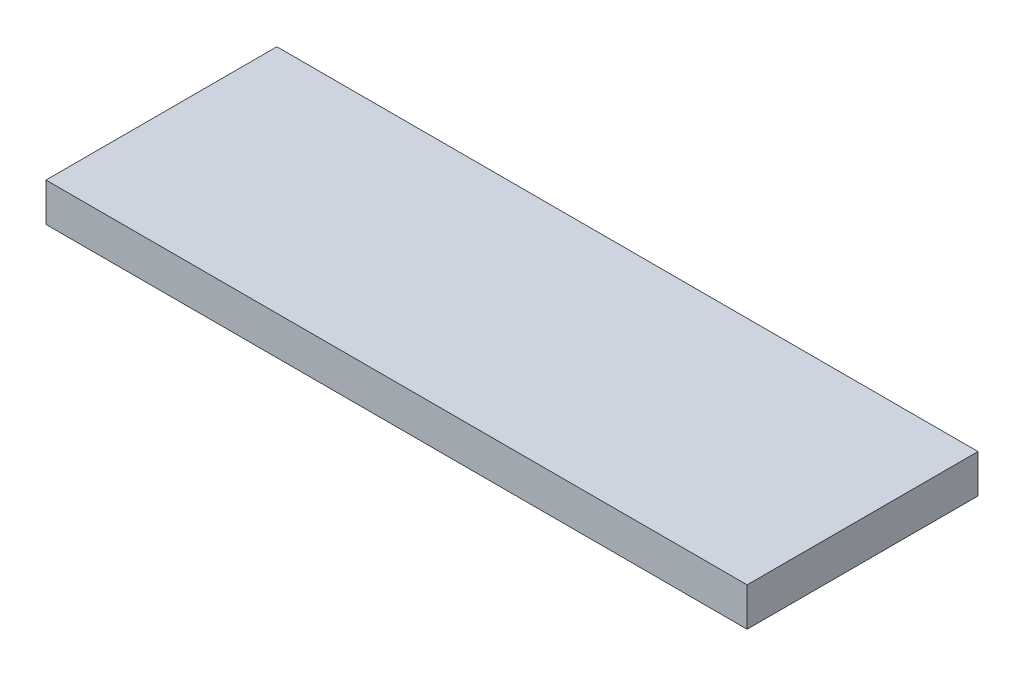
from build123d import *

# Parameters (mm, degrees)
SKICA1_W                = 164
SKICA1_H                = 54
P_IDAT_VYSUNUT_M1_DEPTH = 9


with BuildPart() as part:
    # Skica1 → Přidat vysunutím1 (new body)
    with BuildSketch(Plane(origin=(0, 0, 0), x_dir=(1, 0, 0), z_dir=(0, 1, 0))):
        Rectangle(SKICA1_W, SKICA1_H)
    extrude(amount=P_IDAT_VYSUNUT_M1_DEPTH)


solid = part.part
